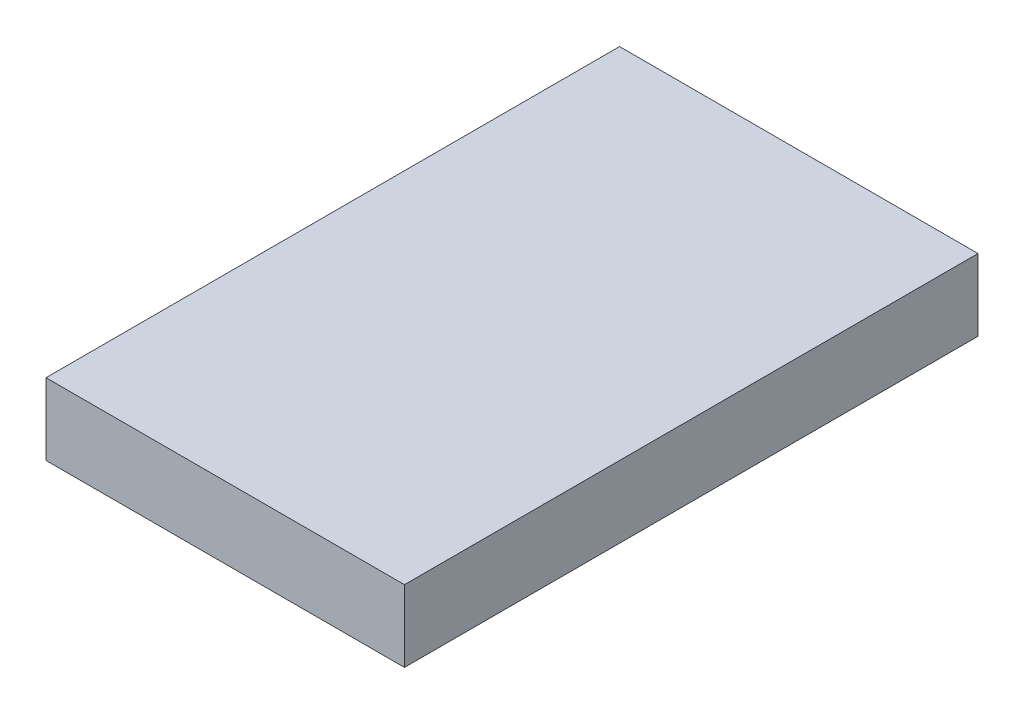
from build123d import *

# Parameters (mm, degrees)
SKETCH1_W           = 30
SKETCH1_H           = 48
BOSS_EXTRUDE1_DEPTH = 6


with BuildPart() as part:
    # Sketch1 → Boss-Extrude1 (new body)
    with BuildSketch(Plane(origin=(0, 0, 0), x_dir=(1, 0, 0), z_dir=(0, 1, 0))):
        Rectangle(SKETCH1_W, SKETCH1_H)
    extrude(amount=BOSS_EXTRUDE1_DEPTH)


solid = part.part
